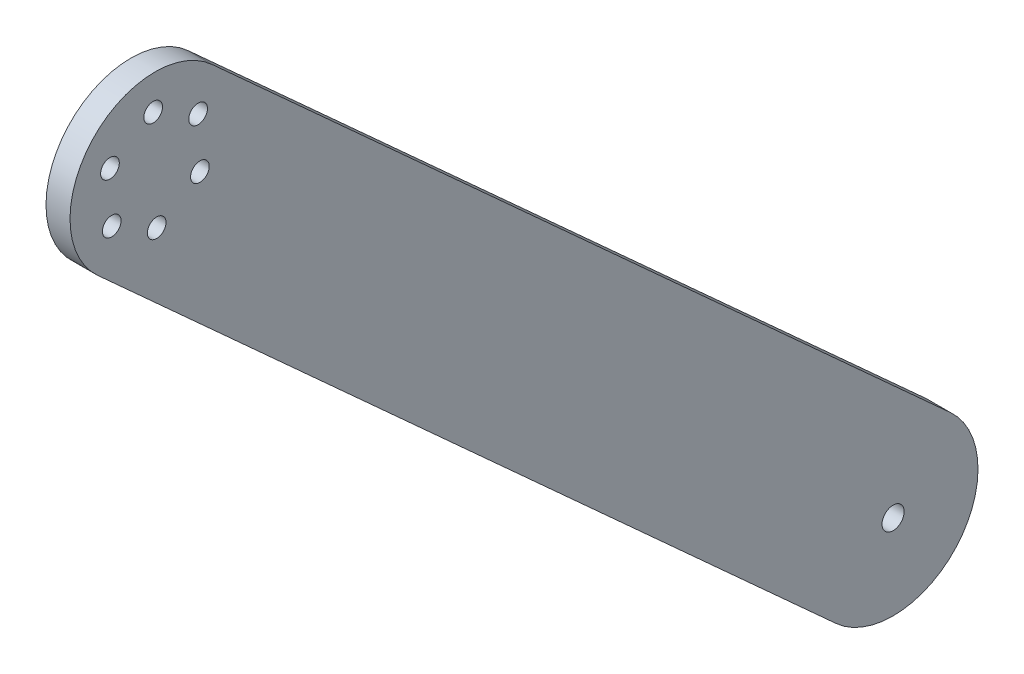
from build123d import *

# Parameters (mm, degrees)
SKETCH1_R           = 2.6067
SKETCH1_R_2         = 2.2
BOSS_EXTRUDE1_DEPTH = 5.661


with BuildPart() as part:
    # Sketch1 → Boss-Extrude1 (new body)
    with BuildSketch(Plane(origin=(0, 0, 0), x_dir=(0, 0, -1), z_dir=(1, 0, 0))):
        with BuildLine():
            Line((-73.497033315, 93.769337174), (100.389889855, -64.158962858))
            ThreePointArc((100.389889855, -64.158962858), (101.748648742, -92.410578286), (73.497033315, -93.769337174))
            Line((73.497033315, -93.769337174), (-100.389889855, 64.158962858))
            ThreePointArc((-100.389889855, 64.158962858), (-101.748648742, 92.410578286), (-73.497033315, 93.769337174))
        make_face()
        with Locations((86.943461585, -78.964150016)):
            Circle(SKETCH1_R, mode=Mode.SUBTRACT)
        with Locations((-97.122561671, 72.609158165)):
            Circle(SKETCH1_R_2, mode=Mode.SUBTRACT)
        with Locations((-97.536596012, 84.602013353)):
            Circle(SKETCH1_R_2, mode=Mode.SUBTRACT)
        with Locations((-87.357495925, 90.957005204)):
            Circle(SKETCH1_R_2, mode=Mode.SUBTRACT)
        with Locations((-76.764361498, 85.319141867)):
            Circle(SKETCH1_R_2, mode=Mode.SUBTRACT)
        with Locations((-76.350327157, 73.326286678)):
            Circle(SKETCH1_R_2, mode=Mode.SUBTRACT)
        with Locations((-86.529427244, 66.971294827)):
            Circle(SKETCH1_R_2, mode=Mode.SUBTRACT)
    extrude(amount=BOSS_EXTRUDE1_DEPTH)


solid = part.part
